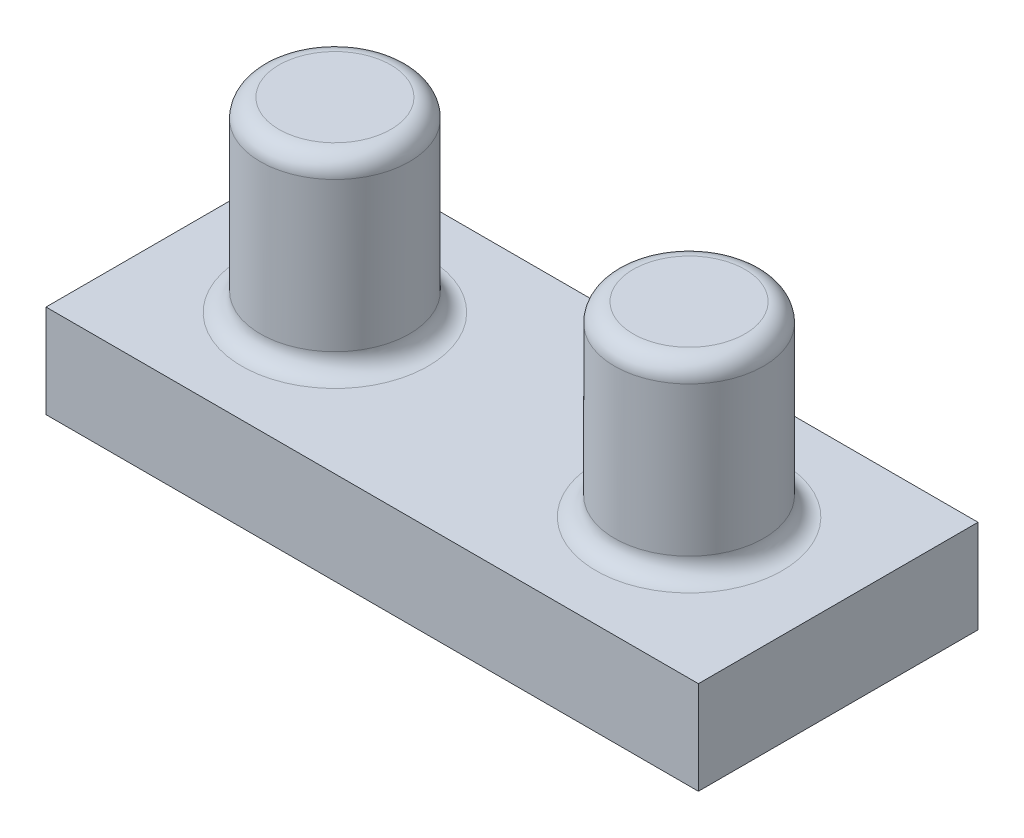
from build123d import *

# Parameters (mm, degrees)
SKETCH1_R             = 4
BOSS_EXTRUDE1_DEPTH   = 10
BOSS_EXTRUDE1_2_DEPTH = 10
SKETCH2_W             = 35
SKETCH2_H             = 15
BOSS_EXTRUDE2_DEPTH   = 5
FILLET1_R             = 1
CUT_EXTRUDE1_DEPTH    = 1


with BuildPart() as part:
    # Sketch1 → Boss-Extrude1 (new body)
    with BuildSketch(Plane(origin=(0, 0, 0), x_dir=(1, 0, 0), z_dir=(0, 1, 0))):
        with Locations(Location((8.086709746, 7.169703638, 0), (0, 0, 270))):
            Circle(SKETCH1_R)
    extrude(amount=BOSS_EXTRUDE1_DEPTH)



with BuildPart() as body_2:
    # Sketch1 → Boss-Extrude1 2 (new body)
    with BuildSketch(Plane(origin=(0, 0, 0), x_dir=(1, 0, 0), z_dir=(0, 1, 0))):
        with Locations(Location((-10.913290254, 7.169703638, 0), (0, 0, 270))):
            Circle(SKETCH1_R)
    extrude(amount=BOSS_EXTRUDE1_2_DEPTH)


with BuildPart() as part_1:
    add(part.part)

    add(body_2.part)  # Boss-Extrude2 merges body 2
    # Sketch2 → Boss-Extrude2 (add)
    with BuildSketch(Plane(origin=(0, 0, 0), x_dir=(-1, 0, 0), z_dir=(0, -1, 0))):
        with Locations((1.413290254, 7.169703638)):
            Rectangle(SKETCH2_W, SKETCH2_H)
    extrude(amount=BOSS_EXTRUDE2_DEPTH)

    # Fillet1
    fillet1_edges = [part_1.edges().sort_by_distance(p)[0] for p in [
        (-10.913290254, 0, -11.169703638),
        (-10.913290254, 10, -11.169703638),
        (8.086709746, 10, -11.169703638),
        (8.086709746, 0, -11.169703638),
    ]]
    fillet(fillet1_edges, radius=FILLET1_R)

    # Sketch3 → Cut-Extrude1 (cut)
    # profile 1 of 4: a face of its own
    with BuildSketch(Plane(origin=(0, 0, -14.669703638), x_dir=(-1, 0, 0), z_dir=(0, 0, -1))):
        with BuildLine():
            Line((4.304418078, -1.853490886), (4.618520642, -1.853490886))
            Line((4.618520642, -1.853490886), (4.618520642, -2.298002104))
            add(Edge.make_bspline(
                [(4.618520642, -2.298002104), (4.646804592, -2.259114502), (4.700999351, -2.184602129), (4.789865004, -2.086411845), (4.878641116, -2.00308369), (4.942574498, -1.959340819), (4.97328827, -1.938326623)],
                knots=[0, 0, 0, 0, 1.134379233, 2.173579362, 3.122582517, 4, 4, 4, 4], degree=3))
            add(Edge.make_bspline(
                [(4.97328827, -1.938326623), (5.015152932, -1.918321258), (5.098150832, -1.878660045), (5.229570057, -1.838426486), (5.364044726, -1.813701385), (5.45485294, -1.810320011), (5.50053186, -1.808619091)],
                knots=[0, 0, 0, 0, 1.014936303, 2.012140481, 3.000054389, 4, 4, 4, 4], degree=3))
            add(Edge.make_bspline(
                [(5.50053186, -1.808619091), (5.531424856, -1.809664382), (5.592560435, -1.811732956), (5.683144526, -1.825192992), (5.771003137, -1.848459165), (5.855617167, -1.880866489), (5.935337846, -1.920113175), (6.008427044, -1.966162883), (6.074051252, -2.017859959), (6.132177303, -2.077538892), (6.184446329, -2.14687549), (6.232525175, -2.227739739), (6.276950388, -2.3219474), (6.301571696, -2.390313941), (6.314534264, -2.426307393)],
                knots=[0, 0, 0, 0, 1.009824226, 1.998387844, 2.986035974, 3.974953746, 4.955485308, 5.885931332, 6.793869504, 7.679848016, 8.601185859, 9.625726857, 10.749998409, 12, 12, 12, 12], degree=3))
            add(Edge.make_bspline(
                [(6.314534264, -2.426307393), (6.328245515, -2.401582973), (6.355227332, -2.352928788), (6.400532969, -2.284070526), (6.448000766, -2.219663734), (6.498035259, -2.15965731), (6.550459846, -2.10434758), (6.605521246, -2.053551678), (6.662906027, -2.007051464), (6.742698267, -1.952728305), (6.846510875, -1.895027123), (6.977398989, -1.844998679), (7.113549161, -1.814082551), (7.205966859, -1.810452278), (7.252635225, -1.808619091)],
                knots=[0, 0, 0, 0, 0.86119277, 1.694706429, 2.50939023, 3.298075842, 4.073795165, 4.829715201, 5.57930267, 6.321991688, 7.768977793, 9.186738141, 10.579381044, 12, 12, 12, 12], degree=3))
            add(Edge.make_bspline(
                [(7.252635225, -1.808619091), (7.295516688, -1.810236312), (7.379439874, -1.81340137), (7.50161714, -1.838254844), (7.615558945, -1.880932491), (7.721036021, -1.939166127), (7.816195835, -2.012345311), (7.898912144, -2.099414148), (7.968682507, -2.199756771), (8.014261147, -2.29414876), (8.045176411, -2.377484093), (8.064237646, -2.448490384), (8.081077341, -2.526641937), (8.095058586, -2.612032199), (8.105277138, -2.704962807), (8.112847854, -2.805281683), (8.117971927, -2.913066794), (8.118333999, -2.987432295), (8.118520642, -3.025766527)],
                knots=[0, 0, 0, 0, 1.209669288, 2.367440248, 3.500751976, 4.631527125, 5.755587489, 6.87532382, 8.007944318, 9.190864318, 9.82315674, 10.514484317, 11.263564316, 12.079023757, 12.955305781, 13.901327259, 14.918167583, 16, 16, 16, 16], degree=3))
            Line((8.118520642, -3.025766527), (8.118520642, -4.411183194))
            Line((8.118520642, -4.411183194), (7.804418078, -4.411183194))
            Line((7.804418078, -4.411183194), (7.804418078, -3.024364284))
            add(Edge.make_bspline(
                [(7.804418078, -3.024364284), (7.804340195, -2.99164371), (7.804190516, -2.928759743), (7.801496884, -2.838507292), (7.79642157, -2.756238934), (7.790486931, -2.682066846), (7.782243122, -2.615818058), (7.77159719, -2.557625639), (7.76031951, -2.507031828), (7.741583519, -2.45094578), (7.711635627, -2.38907557), (7.666018147, -2.322351994), (7.608548041, -2.264271194), (7.542187885, -2.213852877), (7.46663944, -2.172859236), (7.383374717, -2.143583226), (7.292910665, -2.125460348), (7.230287877, -2.123654332), (7.197947725, -2.122721655)],
                knots=[0, 0, 0, 0, 1.253487763, 2.409012846, 3.458416907, 4.410876679, 5.259312806, 6.014470957, 6.676830364, 7.243083969, 8.276244668, 9.299465089, 10.325150304, 11.392391894, 12.482080715, 13.603491619, 14.762376348, 16, 16, 16, 16], degree=3))
            add(Edge.make_bspline(
                [(7.197947725, -2.122721655), (7.158277771, -2.124137813), (7.07987486, -2.126936678), (6.965429373, -2.155510551), (6.855458357, -2.198590802), (6.753243224, -2.261023259), (6.659215433, -2.335831623), (6.578315856, -2.424781219), (6.51148367, -2.525411146), (6.466229694, -2.618557848), (6.437640393, -2.702227292), (6.418763477, -2.775324664), (6.404080085, -2.858406232), (6.390309556, -2.950913722), (6.381321828, -3.053483903), (6.373153456, -3.165642304), (6.369332593, -3.287726263), (6.368798134, -3.372352952), (6.368520642, -3.416291367)],
                knots=[0, 0, 0, 0, 1.090531906, 2.155305635, 3.229839962, 4.33261226, 5.44038871, 6.529323825, 7.629011124, 8.757537029, 9.370236727, 10.061839251, 10.834451254, 11.692844982, 12.636905849, 13.66920014, 14.789842145, 16, 16, 16, 16], degree=3))
            Line((6.368520642, -3.416291367), (6.368520642, -4.411183194))
            Line((6.368520642, -4.411183194), (6.054418078, -4.411183194))
            Line((6.054418078, -4.411183194), (6.054418078, -3.110602264))
            add(Edge.make_bspline(
                [(6.054418078, -3.110602264), (6.054338647, -3.073908946), (6.05418583, -3.003314688), (6.051509512, -2.902081013), (6.046422891, -2.809999933), (6.040542342, -2.727178469), (6.032082164, -2.65376714), (6.022472402, -2.589372382), (6.011123791, -2.534155631), (5.992333906, -2.473592247), (5.963619438, -2.406871324), (5.917431176, -2.335730302), (5.859823596, -2.273462205), (5.79225272, -2.220303456), (5.716247038, -2.176361975), (5.632263637, -2.144702223), (5.541058724, -2.126277934), (5.478181018, -2.123929437), (5.44584436, -2.122721655)],
                knots=[0, 0, 0, 0, 1.320475261, 2.540461679, 3.643808994, 4.639130445, 5.527981419, 6.302341397, 6.981980563, 7.553956391, 8.582137848, 9.585246428, 10.591171744, 11.620968678, 12.668337649, 13.738356861, 14.836885341, 16, 16, 16, 16], degree=3))
            add(Edge.make_bspline(
                [(5.44584436, -2.122721655), (5.407828148, -2.124252115), (5.332063189, -2.127302268), (5.220761219, -2.154756542), (5.113275536, -2.197760617), (5.011320837, -2.257420436), (4.917646689, -2.331319514), (4.835638421, -2.41823441), (4.766695896, -2.517083444), (4.720964081, -2.60924796), (4.691465607, -2.690821235), (4.671870272, -2.760172183), (4.655030646, -2.837172431), (4.642516625, -2.922059542), (4.630436209, -3.014280636), (4.6246059, -3.114295126), (4.618934338, -3.222017214), (4.618661923, -3.296389759), (4.618520642, -3.334961239)],
                knots=[0, 0, 0, 0, 1.098833095, 2.189935336, 3.297829714, 4.440610912, 5.596351641, 6.740013378, 7.886572111, 9.072425424, 9.705826452, 10.395263256, 11.156850408, 11.985370555, 12.878090359, 13.847760091, 14.883794034, 16, 16, 16, 16], degree=3))
            Line((4.618520642, -3.334961239), (4.618520642, -4.411183194))
            Line((4.618520642, -4.411183194), (4.304418078, -4.411183194))
            Line((4.304418078, -4.411183194), (4.304418078, -1.853490886))
        make_face()
    # profile 2 of 4: a face of its own
    with BuildSketch(Plane(origin=(0, 0, -14.669703638), x_dir=(-1, 0, 0), z_dir=(0, 0, -1))):
        with BuildLine():
            Line((-0.227633204, -1.853490886), (0.08646936, -1.853490886))
            Line((0.08646936, -1.853490886), (0.08646936, -2.298002104))
            add(Edge.make_bspline(
                [(0.08646936, -2.298002104), (0.11475331, -2.259114502), (0.168948069, -2.184602129), (0.257813722, -2.086411845), (0.346589834, -2.00308369), (0.410523216, -1.959340819), (0.441236988, -1.938326623)],
                knots=[0, 0, 0, 0, 1.134379233, 2.173579362, 3.122582517, 4, 4, 4, 4], degree=3))
            add(Edge.make_bspline(
                [(0.441236988, -1.938326623), (0.48310165, -1.918321258), (0.56609955, -1.878660045), (0.697518775, -1.838426486), (0.831993444, -1.813701385), (0.922801658, -1.810320011), (0.968480578, -1.808619091)],
                knots=[0, 0, 0, 0, 1.014936303, 2.012140481, 3.000054389, 4, 4, 4, 4], degree=3))
            add(Edge.make_bspline(
                [(0.968480578, -1.808619091), (0.999373574, -1.809664382), (1.060509153, -1.811732956), (1.151093243, -1.825192992), (1.238951855, -1.848459165), (1.323565885, -1.880866489), (1.403286564, -1.920113175), (1.476375762, -1.966162883), (1.54199997, -2.017859959), (1.600126021, -2.077538892), (1.652395047, -2.14687549), (1.700473893, -2.227739739), (1.744899106, -2.3219474), (1.769520414, -2.390313941), (1.782482982, -2.426307393)],
                knots=[0, 0, 0, 0, 1.009824226, 1.998387844, 2.986035974, 3.974953746, 4.955485308, 5.885931332, 6.793869504, 7.679848016, 8.601185859, 9.625726857, 10.749998409, 12, 12, 12, 12], degree=3))
            add(Edge.make_bspline(
                [(1.782482982, -2.426307393), (1.796194233, -2.401582973), (1.82317605, -2.352928788), (1.868481687, -2.284070526), (1.915949484, -2.219663734), (1.965983977, -2.15965731), (2.018408564, -2.10434758), (2.073469964, -2.053551678), (2.130854745, -2.007051464), (2.210646985, -1.952728305), (2.314459593, -1.895027123), (2.445347707, -1.844998679), (2.581497879, -1.814082551), (2.673915577, -1.810452278), (2.720583943, -1.808619091)],
                knots=[0, 0, 0, 0, 0.86119277, 1.694706429, 2.50939023, 3.298075842, 4.073795165, 4.829715201, 5.57930267, 6.321991688, 7.768977793, 9.186738141, 10.579381044, 12, 12, 12, 12], degree=3))
            add(Edge.make_bspline(
                [(2.720583943, -1.808619091), (2.763465406, -1.810236312), (2.847388592, -1.81340137), (2.969565858, -1.838254844), (3.083507663, -1.880932491), (3.188984739, -1.939166127), (3.284144553, -2.012345311), (3.366860862, -2.099414148), (3.436631225, -2.199756771), (3.482209865, -2.29414876), (3.513125129, -2.377484093), (3.532186364, -2.448490384), (3.549026059, -2.526641937), (3.563007304, -2.612032199), (3.573225856, -2.704962807), (3.580796572, -2.805281683), (3.585920645, -2.913066794), (3.586282717, -2.987432295), (3.58646936, -3.025766527)],
                knots=[0, 0, 0, 0, 1.209669288, 2.367440248, 3.500751976, 4.631527125, 5.755587489, 6.87532382, 8.007944318, 9.190864318, 9.82315674, 10.514484317, 11.263564316, 12.079023757, 12.955305781, 13.901327259, 14.918167583, 16, 16, 16, 16], degree=3))
            Line((3.58646936, -3.025766527), (3.58646936, -4.411183194))
            Line((3.58646936, -4.411183194), (3.272366796, -4.411183194))
            Line((3.272366796, -4.411183194), (3.272366796, -3.024364284))
            add(Edge.make_bspline(
                [(3.272366796, -3.024364284), (3.272288913, -2.99164371), (3.272139234, -2.928759743), (3.269445602, -2.838507292), (3.264370288, -2.756238934), (3.258435649, -2.682066846), (3.25019184, -2.615818058), (3.239545908, -2.557625639), (3.228268228, -2.507031828), (3.209532237, -2.45094578), (3.179584345, -2.38907557), (3.133966865, -2.322351994), (3.076496759, -2.264271194), (3.010136603, -2.213852877), (2.934588158, -2.172859236), (2.851323435, -2.143583226), (2.760859383, -2.125460348), (2.698236595, -2.123654332), (2.665896443, -2.122721655)],
                knots=[0, 0, 0, 0, 1.253487763, 2.409012846, 3.458416907, 4.410876679, 5.259312806, 6.014470957, 6.676830364, 7.243083969, 8.276244668, 9.299465089, 10.325150304, 11.392391894, 12.482080715, 13.603491619, 14.762376348, 16, 16, 16, 16], degree=3))
            add(Edge.make_bspline(
                [(2.665896443, -2.122721655), (2.626226489, -2.124137813), (2.547823578, -2.126936678), (2.433378091, -2.155510551), (2.323407075, -2.198590802), (2.221191942, -2.261023259), (2.127164151, -2.335831623), (2.046264573, -2.424781219), (1.979432388, -2.525411146), (1.934178412, -2.618557848), (1.905589111, -2.702227292), (1.886712195, -2.775324664), (1.872028803, -2.858406232), (1.858258274, -2.950913722), (1.849270546, -3.053483903), (1.841102174, -3.165642304), (1.837281311, -3.287726263), (1.836746852, -3.372352952), (1.83646936, -3.416291367)],
                knots=[0, 0, 0, 0, 1.090531906, 2.155305635, 3.229839962, 4.33261226, 5.44038871, 6.529323825, 7.629011124, 8.757537029, 9.370236727, 10.061839251, 10.834451254, 11.692844982, 12.636905849, 13.66920014, 14.789842145, 16, 16, 16, 16], degree=3))
            Line((1.83646936, -3.416291367), (1.83646936, -4.411183194))
            Line((1.83646936, -4.411183194), (1.522366796, -4.411183194))
            Line((1.522366796, -4.411183194), (1.522366796, -3.110602264))
            add(Edge.make_bspline(
                [(1.522366796, -3.110602264), (1.522287365, -3.073908946), (1.522134548, -3.003314688), (1.51945823, -2.902081013), (1.514371609, -2.809999933), (1.50849106, -2.727178469), (1.500030882, -2.65376714), (1.49042112, -2.589372382), (1.479072509, -2.534155631), (1.460282624, -2.473592247), (1.431568156, -2.406871324), (1.385379894, -2.335730302), (1.327772314, -2.273462205), (1.260201438, -2.220303456), (1.184195756, -2.176361975), (1.100212355, -2.144702223), (1.009007442, -2.126277934), (0.946129736, -2.123929437), (0.913793078, -2.122721655)],
                knots=[0, 0, 0, 0, 1.320475261, 2.540461679, 3.643808994, 4.639130445, 5.527981419, 6.302341397, 6.981980563, 7.553956391, 8.582137848, 9.585246428, 10.591171744, 11.620968678, 12.668337649, 13.738356861, 14.836885341, 16, 16, 16, 16], degree=3))
            add(Edge.make_bspline(
                [(0.913793078, -2.122721655), (0.875776866, -2.124252115), (0.800011907, -2.127302268), (0.688709937, -2.154756542), (0.581224254, -2.197760617), (0.479269555, -2.257420436), (0.385595407, -2.331319514), (0.303587139, -2.41823441), (0.234644614, -2.517083444), (0.188912799, -2.60924796), (0.159414325, -2.690821235), (0.13981899, -2.760172183), (0.122979364, -2.837172431), (0.110465342, -2.922059542), (0.098384927, -3.014280636), (0.092554618, -3.114295126), (0.086883056, -3.222017214), (0.086610641, -3.296389759), (0.08646936, -3.334961239)],
                knots=[0, 0, 0, 0, 1.098833095, 2.189935336, 3.297829714, 4.440610912, 5.596351641, 6.740013378, 7.886572111, 9.072425424, 9.705826452, 10.395263256, 11.156850408, 11.985370555, 12.878090359, 13.847760091, 14.883794034, 16, 16, 16, 16], degree=3))
            Line((0.08646936, -3.334961239), (0.08646936, -4.411183194))
            Line((0.08646936, -4.411183194), (-0.227633204, -4.411183194))
            Line((-0.227633204, -4.411183194), (-0.227633204, -1.853490886))
        make_face()
    # profile 3 of 4: a face of its own
    with BuildSketch(Plane(origin=(0, 0, -14.669703638), x_dir=(-1, 0, 0), z_dir=(0, 0, -1))):
        with BuildLine():
            Line((-3.727633204, -4.500926784), (-3.978634807, -4.326347457))
            Line((-3.978634807, -4.326347457), (-3.005477756, -2.903771335))
            add(Edge.make_bspline(
                [(-3.005477756, -2.903771335), (-3.067568491, -2.911364398), (-3.189828611, -2.926315563), (-3.312965713, -2.929062218), (-3.373566698, -2.930413963)],
                knots=[0, 0, 0, 0, 1.015715272, 2, 2, 2, 2], degree=3))
            add(Edge.make_bspline(
                [(-3.373566698, -2.930413963), (-3.410308746, -2.929472887), (-3.482430173, -2.927625636), (-3.588461825, -2.912983828), (-3.690347386, -2.8904337), (-3.787816742, -2.856784945), (-3.881236246, -2.814966736), (-3.97040196, -2.763109722), (-4.05519385, -2.702103431), (-4.13470126, -2.632270439), (-4.207012999, -2.555592387), (-4.271436297, -2.474436744), (-4.324977429, -2.387860773), (-4.369454014, -2.297630553), (-4.403184468, -2.202449203), (-4.427747005, -2.103399802), (-4.44286936, -1.99978816), (-4.444668455, -1.92926303), (-4.445581922, -1.893454829)],
                knots=[0, 0, 0, 0, 1.060718605, 2.082097864, 3.085795603, 4.069760067, 5.054557537, 6.03741023, 7.043284206, 8.066802108, 9.088538119, 10.083643548, 11.053783639, 12.022749082, 12.983451788, 13.964007469, 14.966251758, 16, 16, 16, 16], degree=3))
            add(Edge.make_bspline(
                [(-4.445581922, -1.893454829), (-4.443847487, -1.844486176), (-4.440443144, -1.748370644), (-4.413044627, -1.607936875), (-4.367984287, -1.475150332), (-4.305155911, -1.350360138), (-4.226021189, -1.235361398), (-4.130912599, -1.131752789), (-4.020408635, -1.041007936), (-3.897026616, -0.963003858), (-3.763673595, -0.900268861), (-3.624004937, -0.85402956), (-3.479090817, -0.826830812), (-3.380923147, -0.823244951), (-3.33149939, -0.821439604)],
                knots=[0, 0, 0, 0, 1.022988612, 2.007919123, 2.978103895, 3.94594894, 4.918897164, 5.887013414, 6.875921846, 7.89917871, 8.930658928, 9.948724884, 10.967259574, 12, 12, 12, 12], degree=3))
            add(Edge.make_bspline(
                [(-3.33149939, -0.821439604), (-3.283010971, -0.823269767), (-3.187202424, -0.826885997), (-3.046313417, -0.853369966), (-2.9113724, -0.898006639), (-2.783127414, -0.959691203), (-2.664388001, -1.03701211), (-2.55761219, -1.129146634), (-2.465236651, -1.236152161), (-2.38741277, -1.355440651), (-2.32494273, -1.483607632), (-2.279870447, -1.617391555), (-2.252124808, -1.755830276), (-2.248628481, -1.84962475), (-2.246863974, -1.896960438)],
                knots=[0, 0, 0, 0, 1.026385292, 2.028040595, 3.023318987, 4.028184125, 5.03290303, 6.015178782, 7.004435299, 8.016004309, 9.023023918, 10.015172535, 10.998308025, 12, 12, 12, 12], degree=3))
            add(Edge.make_bspline(
                [(-2.246863974, -1.896960438), (-2.248042382, -1.933704205), (-2.25043249, -2.008229745), (-2.267168797, -2.121460088), (-2.295588982, -2.236911318), (-2.327840681, -2.334632913), (-2.358972849, -2.415341363), (-2.388273981, -2.479092943), (-2.420786134, -2.546194206), (-2.4587049, -2.615941544), (-2.499467196, -2.689224079), (-2.545526473, -2.765306795), (-2.595832045, -2.844291788), (-2.631661764, -2.897538876), (-2.650009006, -2.924804989)],
                knots=[0, 0, 0, 0, 1.179839688, 2.393009684, 3.667231171, 4.993948276, 5.694988576, 6.444077775, 7.246288328, 8.089075292, 8.993003841, 9.939041771, 10.944649915, 12, 12, 12, 12], degree=3))
            Line((-2.650009006, -2.924804989), (-3.727633204, -4.500926784))
        make_face()
        with BuildLine():
            add(Edge.make_bspline(
                [(-3.315373589, -2.571439604), (-3.287539575, -2.57067922), (-3.233356212, -2.569199012), (-3.153978913, -2.56018977), (-3.079054709, -2.544215784), (-3.00838346, -2.521296072), (-2.941256558, -2.493639403), (-2.87874023, -2.458427417), (-2.820782155, -2.416410782), (-2.766994228, -2.369200766), (-2.719230228, -2.316750183), (-2.676687197, -2.261853076), (-2.64052663, -2.204268466), (-2.611963353, -2.143275204), (-2.588478777, -2.080357995), (-2.572260765, -2.01450364), (-2.563276432, -1.946055239), (-2.561744857, -1.899556581), (-2.560966538, -1.875926784)],
                knots=[0, 0, 0, 0, 1.163407946, 2.26475976, 3.333800367, 4.359385343, 5.366239384, 6.363380779, 7.350133999, 8.353570782, 9.349036268, 10.310270964, 11.253520213, 12.184142, 13.120487599, 14.056272588, 15.012232024, 16, 16, 16, 16], degree=3))
            add(Edge.make_bspline(
                [(-2.560966538, -1.875926784), (-2.561636207, -1.852287118), (-2.562955872, -1.805702258), (-2.573543172, -1.737152519), (-2.592168395, -1.671459258), (-2.61715888, -1.608262828), (-2.650079117, -1.548082456), (-2.689582603, -1.490162584), (-2.736515053, -1.434870456), (-2.790517619, -1.383506473), (-2.848752172, -1.336158574), (-2.910812672, -1.294372498), (-2.976187588, -1.259351301), (-3.044478078, -1.230452331), (-3.115826427, -1.207900556), (-3.190190415, -1.191683191), (-3.267945821, -1.182711436), (-3.320727107, -1.181189542), (-3.347625191, -1.180413963)],
                knots=[0, 0, 0, 0, 0.972161553, 1.915763587, 2.844109794, 3.775983486, 4.705125789, 5.659731448, 6.655561913, 7.682237399, 8.721216875, 9.739758359, 10.754845918, 11.767244016, 12.7857855, 13.828538656, 14.893392813, 16, 16, 16, 16], degree=3))
            add(Edge.make_bspline(
                [(-3.347625191, -1.180413963), (-3.374289345, -1.181190795), (-3.426604194, -1.182714932), (-3.503668354, -1.191666137), (-3.577529521, -1.208009622), (-3.648671142, -1.230441885), (-3.716959602, -1.259353457), (-3.782331435, -1.294374333), (-3.844406452, -1.336148955), (-3.902585173, -1.383543727), (-3.956683095, -1.434631373), (-4.002808624, -1.490404802), (-4.042402516, -1.548052327), (-4.075277518, -1.608270835), (-4.100280036, -1.671457121), (-4.118902037, -1.737153097), (-4.129490203, -1.805702108), (-4.130809749, -1.852287068), (-4.131479358, -1.875926784)],
                knots=[0, 0, 0, 0, 1.099389452, 2.15699305, 3.192601482, 4.213358962, 5.227959689, 6.245255729, 7.266013209, 8.307253147, 9.336162325, 10.327954924, 11.284637477, 12.215801273, 13.149702402, 14.080068371, 15.025723358, 16, 16, 16, 16], degree=3))
            add(Edge.make_bspline(
                [(-4.131479358, -1.875926784), (-4.130873432, -1.899574982), (-4.129678435, -1.946213559), (-4.118150645, -2.014739951), (-4.098872365, -2.080428145), (-4.073052975, -2.143916852), (-4.039051385, -2.204588711), (-3.997327537, -2.262156073), (-3.948421991, -2.317271523), (-3.892988503, -2.369078735), (-3.832320342, -2.41663091), (-3.767523596, -2.458161292), (-3.699713759, -2.493233737), (-3.628652128, -2.52137512), (-3.554865328, -2.543986784), (-3.477690197, -2.560160329), (-3.397381959, -2.569112596), (-3.342971978, -2.570656493), (-3.315373589, -2.571439604)],
                knots=[0, 0, 0, 0, 0.952633368, 1.87876736, 2.791047057, 3.707742249, 4.635551637, 5.587206343, 6.568248508, 7.601284464, 8.641511608, 9.671105535, 10.699146789, 11.713763218, 12.747829548, 13.806491675, 14.887386225, 16, 16, 16, 16], degree=3))
        make_face(mode=Mode.SUBTRACT)
    # profile 4 of 4: a face of its own
    with BuildSketch(Plane(origin=(0, 0, -14.669703638), x_dir=(-1, 0, 0), z_dir=(0, 0, -1))):
        Polygon((-6.438871185, -0.911183194), (-5.791735768, -0.911183194), (-5.791735768, -4.411183194), (-6.105838332, -4.411183194), (-6.105838332, -1.270157553), (-6.644299871, -1.270157553), align=None)
    extrude(amount=-CUT_EXTRUDE1_DEPTH, mode=Mode.SUBTRACT)


solid = part_1.part
